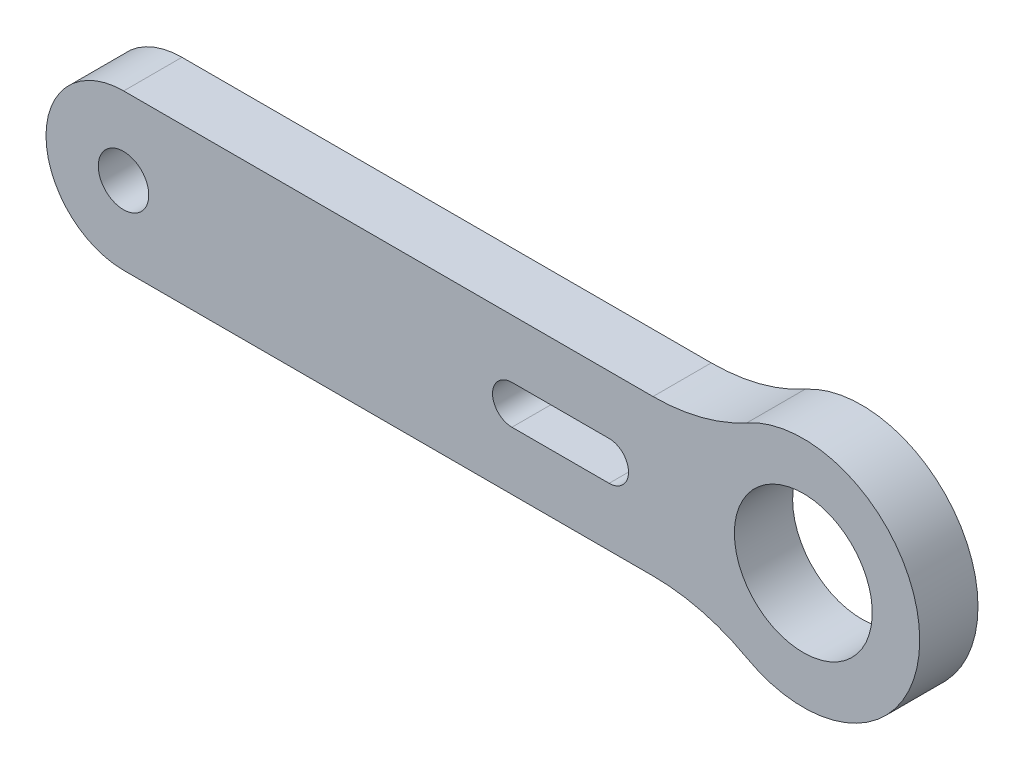
from build123d import *

# Parameters (mm, degrees)
SKETCH_1_R      = 1.3
SKETCH_1_R_2    = 3.55
EXTRUDE_1_DEPTH = 3


with BuildPart() as part:
    # 草图1 → 凸台-拉伸1 (new body)
    with BuildSketch(Plane.XY.offset(3)):
        with BuildLine():
            Line((15.64082314, 8), (-11.611020882, 8))
            ThreePointArc((-11.611020882, 8), (-15.611020882, 4), (-11.611020882, 0))
            Line((-11.611020882, 0), (15.646226321, 0))
            ThreePointArc((15.646226321, 0), (18.142339112, -0.316538794), (20.480428598, -1.246115814))
            ThreePointArc((20.480428598, -1.246115814), (29.372947843, 4.002649377), (20.478403544, 9.247982185))
            ThreePointArc((20.478403544, 9.247982185), (18.13880451, 8.317020651), (15.64082314, 8))
        make_face()
        with Locations(Location((-11.619385977, 4.000182729, 0), (0, 0, 180))):
            Circle(SKETCH_1_R, mode=Mode.SUBTRACT)
        with Locations(Location((23.379334845, 4.0005, 0), (0, 0, 180))):
            Circle(SKETCH_1_R_2, mode=Mode.SUBTRACT)
        with BuildLine():
            Line((13.380380647, 3.000533249), (8.378847398, 3.000533249))
            ThreePointArc((8.378847398, 3.000533249), (7.379114023, 4.000266624), (8.378847398, 5))
            Line((8.378847398, 5), (13.380380647, 5))
            ThreePointArc((13.380380647, 5), (14.380114023, 4.000266624), (13.380380647, 3.000533249))
        make_face(mode=Mode.SUBTRACT)
    extrude(amount=-EXTRUDE_1_DEPTH)


solid = part.part
